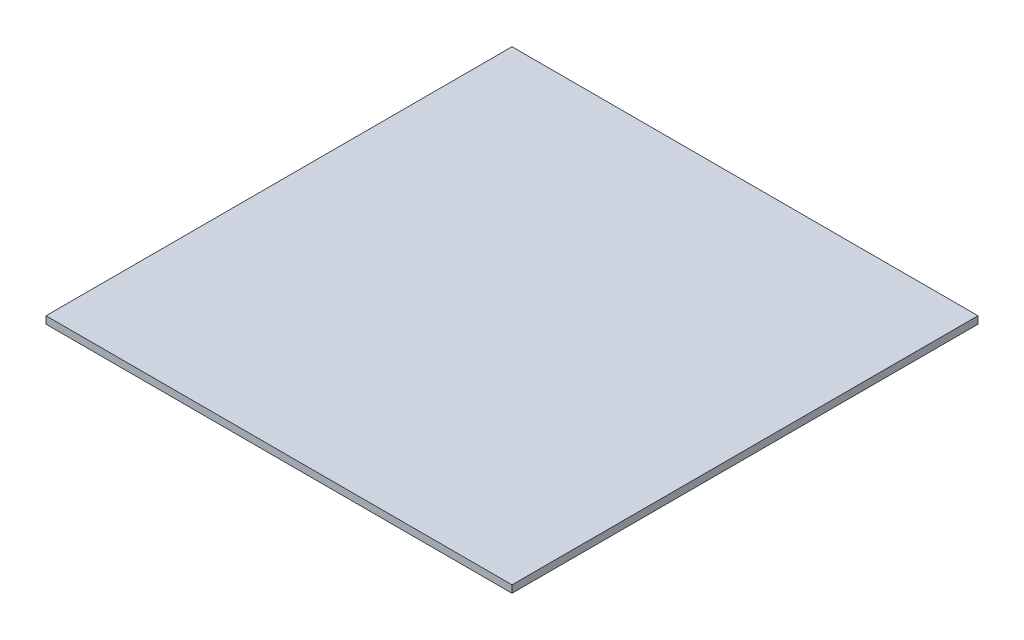
from build123d import *

# Parameters (mm, degrees)
SKETCH1_W           = 63.5
SKETCH1_H           = 63.5
BOSS_EXTRUDE1_DEPTH = 1


with BuildPart() as part:
    # Sketch1 → Boss-Extrude1 (new body)
    with BuildSketch(Plane(origin=(0, 0, 0), x_dir=(1, 0, 0), z_dir=(0, 1, 0))):
        Rectangle(SKETCH1_W, SKETCH1_H)
    extrude(amount=BOSS_EXTRUDE1_DEPTH)


solid = part.part
